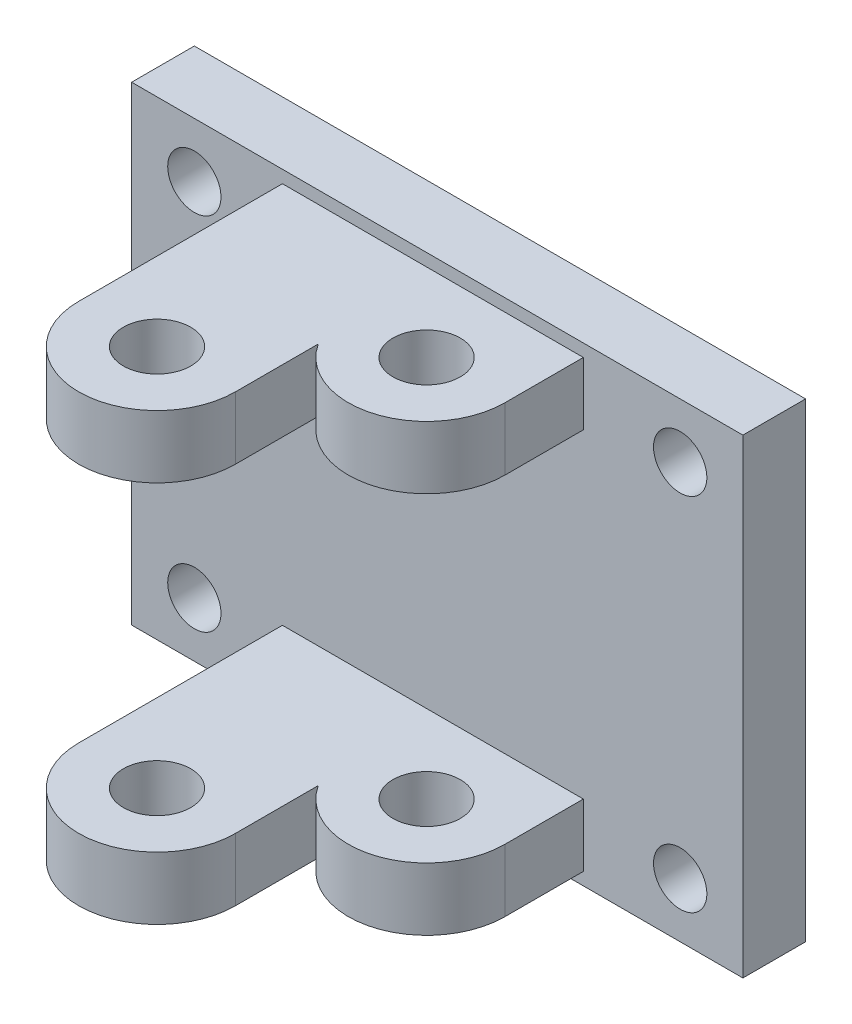
from build123d import *

# Parameters (mm, degrees)
REMOVABLE_ADAPTER_BASE_START           = 4
REMOVABLE_ADAPTER_BASE_PROFILE_W       = 39
REMOVABLE_ADAPTER_BASE_PROFILE_H       = 30
REMOVABLE_ADAPTER_BASE_DEPTH           = 4
LEFT_PIN0_SUPPORT_START                = 10.2
LEFT_PIN0_SUPPORT_PROFILE_W            = 10
LEFT_PIN0_SUPPORT_PROFILE_H            = 13
LEFT_PIN0_SUPPORT_DEPTH                = 4
LEFT_PIN0_ROUNDED_LUG_START            = 10.2
LEFT_PIN0_ROUNDED_LUG_PROFILE_R        = 5
LEFT_PIN0_ROUNDED_LUG_DEPTH            = 4
LEFT_PIN1_SUPPORT_START                = 10.2
LEFT_PIN1_SUPPORT_PROFILE_W            = 10
LEFT_PIN1_SUPPORT_PROFILE_H            = 5
LEFT_PIN1_SUPPORT_DEPTH                = 4
LEFT_PIN1_ROUNDED_LUG_START            = 10.2
LEFT_PIN1_ROUNDED_LUG_PROFILE_R        = 5
LEFT_PIN1_ROUNDED_LUG_DEPTH            = 4
RIGHT_PIN0_SUPPORT_START               = -14.2
RIGHT_PIN0_SUPPORT_PROFILE_W           = 10
RIGHT_PIN0_SUPPORT_PROFILE_H           = 13
RIGHT_PIN0_SUPPORT_DEPTH               = 4
RIGHT_PIN0_ROUNDED_LUG_START           = -14.2
RIGHT_PIN0_ROUNDED_LUG_PROFILE_R       = 5
RIGHT_PIN0_ROUNDED_LUG_DEPTH           = 4
RIGHT_PIN1_SUPPORT_START               = -14.2
RIGHT_PIN1_SUPPORT_PROFILE_W           = 10
RIGHT_PIN1_SUPPORT_PROFILE_H           = 5
RIGHT_PIN1_SUPPORT_DEPTH               = 4
RIGHT_PIN1_ROUNDED_LUG_START           = -14.2
RIGHT_PIN1_ROUNDED_LUG_PROFILE_R       = 5
RIGHT_PIN1_ROUNDED_LUG_DEPTH           = 4
BOTH_M4_GRIPPER_PIN_AXES_START         = -20
BOTH_M4_GRIPPER_PIN_AXES_PROFILE_R     = 2.15
BOTH_M4_GRIPPER_PIN_AXES_DEPTH         = 89.883960397
FOUR_M3_REMOVABLE_DECK_BOLTS_START     = -50
FOUR_M3_REMOVABLE_DECK_BOLTS_PROFILE_R = 1.7
FOUR_M3_REMOVABLE_DECK_BOLTS_DEPTH     = 119.883960397


with BuildPart() as part:
    # Removable_adapter_base_profile → Removable_adapter_base (new body)
    with BuildSketch(Plane.XY.offset(REMOVABLE_ADAPTER_BASE_START)):
        with Locations((42.5, 0)):
            Rectangle(REMOVABLE_ADAPTER_BASE_PROFILE_W, REMOVABLE_ADAPTER_BASE_PROFILE_H)
    extrude(amount=REMOVABLE_ADAPTER_BASE_DEPTH)

    # Left_pin0_support_profile → Left_pin0_support (add)
    with BuildSketch(Plane(origin=(0, 0, 0), x_dir=(1, 0, 0), z_dir=(0, 1, 0)).offset(LEFT_PIN0_SUPPORT_START)):
        with Locations((37.620525892, -14.5)):
            Rectangle(LEFT_PIN0_SUPPORT_PROFILE_W, LEFT_PIN0_SUPPORT_PROFILE_H)
    extrude(amount=LEFT_PIN0_SUPPORT_DEPTH)

    # Left_pin0_rounded_lug_profile → Left_pin0_rounded_lug (add)
    with BuildSketch(Plane(origin=(0, 0, 0), x_dir=(1, 0, 0), z_dir=(0, 1, 0)).offset(LEFT_PIN0_ROUNDED_LUG_START)):
        with Locations((37.620525892, -21)):
            Circle(LEFT_PIN0_ROUNDED_LUG_PROFILE_R)
    extrude(amount=LEFT_PIN0_ROUNDED_LUG_DEPTH)

    # Left_pin1_support_profile → Left_pin1_support (add)
    with BuildSketch(Plane(origin=(0, 0, 0), x_dir=(1, 0, 0), z_dir=(0, 1, 0)).offset(LEFT_PIN1_SUPPORT_START)):
        with Locations((46.820525892, -10.5)):
            Rectangle(LEFT_PIN1_SUPPORT_PROFILE_W, LEFT_PIN1_SUPPORT_PROFILE_H)
    extrude(amount=LEFT_PIN1_SUPPORT_DEPTH)

    # Left_pin1_rounded_lug_profile → Left_pin1_rounded_lug (add)
    with BuildSketch(Plane(origin=(0, 0, 0), x_dir=(1, 0, 0), z_dir=(0, 1, 0)).offset(LEFT_PIN1_ROUNDED_LUG_START)):
        with Locations((46.820525892, -13)):
            Circle(LEFT_PIN1_ROUNDED_LUG_PROFILE_R)
    extrude(amount=LEFT_PIN1_ROUNDED_LUG_DEPTH)

    # Right_pin0_support_profile → Right_pin0_support (add)
    with BuildSketch(Plane(origin=(0, 0, 0), x_dir=(1, 0, 0), z_dir=(0, 1, 0)).offset(RIGHT_PIN0_SUPPORT_START)):
        with Locations((37.620525892, -14.5)):
            Rectangle(RIGHT_PIN0_SUPPORT_PROFILE_W, RIGHT_PIN0_SUPPORT_PROFILE_H)
    extrude(amount=RIGHT_PIN0_SUPPORT_DEPTH)

    # Right_pin0_rounded_lug_profile → Right_pin0_rounded_lug (add)
    with BuildSketch(Plane(origin=(0, 0, 0), x_dir=(1, 0, 0), z_dir=(0, 1, 0)).offset(RIGHT_PIN0_ROUNDED_LUG_START)):
        with Locations((37.620525892, -21)):
            Circle(RIGHT_PIN0_ROUNDED_LUG_PROFILE_R)
    extrude(amount=RIGHT_PIN0_ROUNDED_LUG_DEPTH)

    # Right_pin1_support_profile → Right_pin1_support (add)
    with BuildSketch(Plane(origin=(0, 0, 0), x_dir=(1, 0, 0), z_dir=(0, 1, 0)).offset(RIGHT_PIN1_SUPPORT_START)):
        with Locations((46.820525892, -10.5)):
            Rectangle(RIGHT_PIN1_SUPPORT_PROFILE_W, RIGHT_PIN1_SUPPORT_PROFILE_H)
    extrude(amount=RIGHT_PIN1_SUPPORT_DEPTH)

    # Right_pin1_rounded_lug_profile → Right_pin1_rounded_lug (add)
    with BuildSketch(Plane(origin=(0, 0, 0), x_dir=(1, 0, 0), z_dir=(0, 1, 0)).offset(RIGHT_PIN1_ROUNDED_LUG_START)):
        with Locations((46.820525892, -13)):
            Circle(RIGHT_PIN1_ROUNDED_LUG_PROFILE_R)
    extrude(amount=RIGHT_PIN1_ROUNDED_LUG_DEPTH)

    # Both_M4_gripper_pin_axes_profile → Both_M4_gripper_pin_axes (cut, through all)
    with BuildSketch(Plane(origin=(0, 0, 0), x_dir=(1, 0, 0), z_dir=(0, 1, 0)).offset(BOTH_M4_GRIPPER_PIN_AXES_START)):
        with Locations(Location((37.620525892, -21, 0), (0, 0, 90))):
            Circle(BOTH_M4_GRIPPER_PIN_AXES_PROFILE_R)
        with Locations(Location((46.820525892, -13, 0), (0, 0, 90))):
            Circle(BOTH_M4_GRIPPER_PIN_AXES_PROFILE_R)
    extrude(amount=BOTH_M4_GRIPPER_PIN_AXES_DEPTH, mode=Mode.SUBTRACT)

    # Four_M3_removable_deck_bolts_profile → Four_M3_removable_deck_bolts (cut, through all)
    with BuildSketch(Plane.XY.offset(FOUR_M3_REMOVABLE_DECK_BOLTS_START)):
        with Locations(Location((27, -11.5, 0), (0, 0, 180))):
            Circle(FOUR_M3_REMOVABLE_DECK_BOLTS_PROFILE_R)
        with Locations(Location((27, 11.5, 0), (0, 0, 180))):
            Circle(FOUR_M3_REMOVABLE_DECK_BOLTS_PROFILE_R)
        with Locations(Location((58, -11.5, 0), (0, 0, 180))):
            Circle(FOUR_M3_REMOVABLE_DECK_BOLTS_PROFILE_R)
        with Locations(Location((58, 11.5, 0), (0, 0, 180))):
            Circle(FOUR_M3_REMOVABLE_DECK_BOLTS_PROFILE_R)
    extrude(amount=FOUR_M3_REMOVABLE_DECK_BOLTS_DEPTH, mode=Mode.SUBTRACT)


solid = part.part
